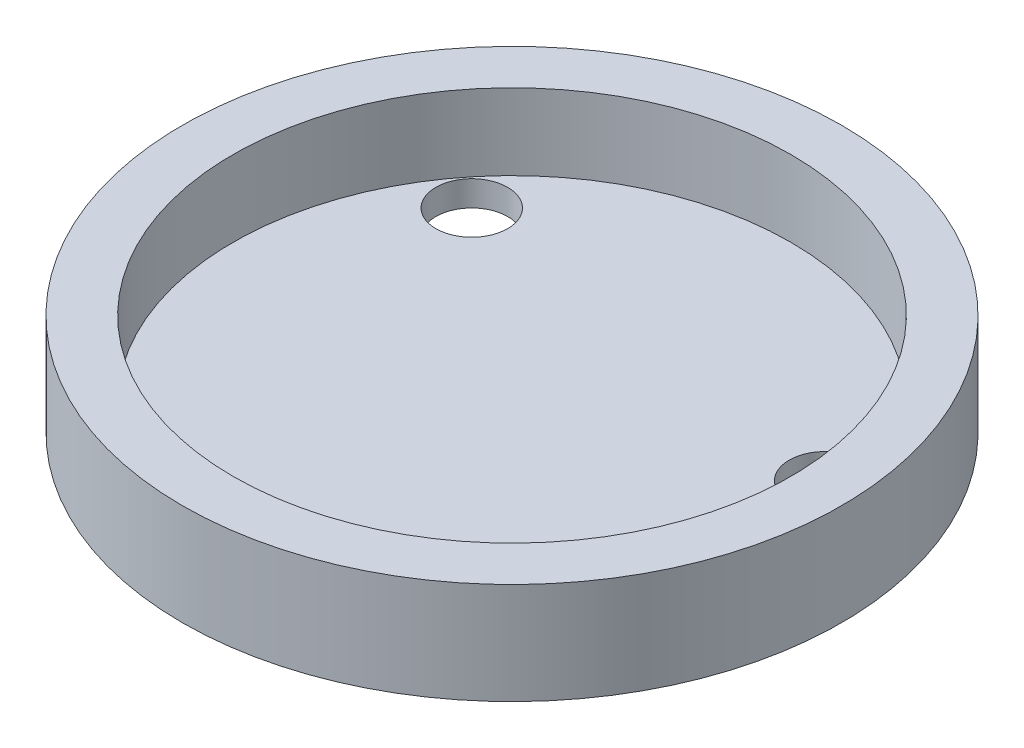
from build123d import *

# Parameters (mm, degrees)
SKETCH1_R                 = 65
BOSS_EXTRUDE1_DEPTH       = 20
SKETCH2_R                 = 55
CUT_EXTRUDE1_DEPTH        = 15
F_1_0MM_DOWEL_HOLE1_D     = 14.15
F_1_0MM_DOWEL_HOLE1_DEPTH = 8.14891112
F_1_0MM_DOWEL_HOLE1_TIP   = 4.25108888


with BuildPart() as part:
    # Sketch1 → Boss-Extrude1 (new body)
    with BuildSketch(Plane(origin=(0, 0, 0), x_dir=(1, 0, 0), z_dir=(0, 1, 0))):
        with Locations(Location((0, 0, 0), (0, 0, 270))):
            Circle(SKETCH1_R)
    extrude(amount=BOSS_EXTRUDE1_DEPTH)

    # Sketch2 → Cut-Extrude1 (cut)
    with BuildSketch(Plane(origin=(0, 20, 0), x_dir=(1, 0, 0), z_dir=(0, 1, 0))):
        with Locations(Location((0, 0, 0), (0, 0, 270))):
            Circle(SKETCH2_R)
    extrude(amount=-CUT_EXTRUDE1_DEPTH, mode=Mode.SUBTRACT)

    # Ø1.0mm Dowel Hole1
    with Locations(Plane(origin=(0, 0, 0), x_dir=(-1, 0, 0), z_dir=(0, -1, 0))):
        with Locations((37.328017274, 29.390801732), (6.7891723, -47.022412098), (-44.117189574, 17.631610366)):
            Hole(F_1_0MM_DOWEL_HOLE1_D / 2, depth=F_1_0MM_DOWEL_HOLE1_DEPTH)
            with Locations((0, 0, -(F_1_0MM_DOWEL_HOLE1_DEPTH + F_1_0MM_DOWEL_HOLE1_TIP / 2))):  # 118° drill point
                Cone(0, F_1_0MM_DOWEL_HOLE1_D / 2, F_1_0MM_DOWEL_HOLE1_TIP, mode=Mode.SUBTRACT)


solid = part.part
